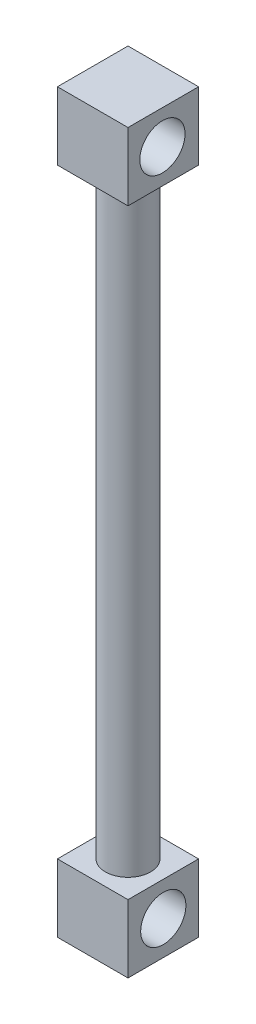
from build123d import *

# Parameters (mm, degrees)
SKETCH2_W           = 0.78
SKETCH2_H           = 1.5
SKETCH2_H_2         = 0.75
BOSS_EXTRUDE1_DEPTH = 1.56
SKETCH3_R           = 0.5
BOSS_EXTRUDE2_DEPTH = 14
SKETCH4_R           = 0.5
CUT_EXTRUDE1_DEPTH  = 14
SKETCH5_R           = 0.5
CUT_EXTRUDE2_DEPTH  = 14


with BuildPart() as part:
    # Sketch2 → Boss-Extrude1 (new body)
    with BuildSketch(Plane.XY):
        with Locations((0.39, -14.03)):
            Rectangle(SKETCH2_W, SKETCH2_H)
        with Locations((1.17, -14.03)):
            Rectangle(SKETCH2_W, SKETCH2_H)
        Polygon((0, 1.5), (0, 0.75), (0.78, 0.75), (0.78, 0), (1.56, 0), (1.56, 1.5), align=None)
        with Locations((0.39, 0.375)):
            Rectangle(SKETCH2_W, SKETCH2_H_2)
    extrude(amount=BOSS_EXTRUDE1_DEPTH)

    # Sketch3 → Boss-Extrude2 (add)
    with BuildSketch(Plane.XZ):
        with Locations(Location((0.78, 0.78, 0), (0, 0, 90))):
            Circle(SKETCH3_R)
    extrude(amount=BOSS_EXTRUDE2_DEPTH)

    # Sketch4 → Cut-Extrude1 (cut)
    with BuildSketch(Plane.ZY):
        with Locations((0.799406884, 0.75)):
            Circle(SKETCH4_R)
    extrude(amount=-CUT_EXTRUDE1_DEPTH, mode=Mode.SUBTRACT)

    # Sketch5 → Cut-Extrude2 (cut)
    with BuildSketch(Plane.ZY):
        with Locations((0.78, -14.03)):
            Circle(SKETCH5_R)
    extrude(amount=-CUT_EXTRUDE2_DEPTH, mode=Mode.SUBTRACT)


solid = part.part
